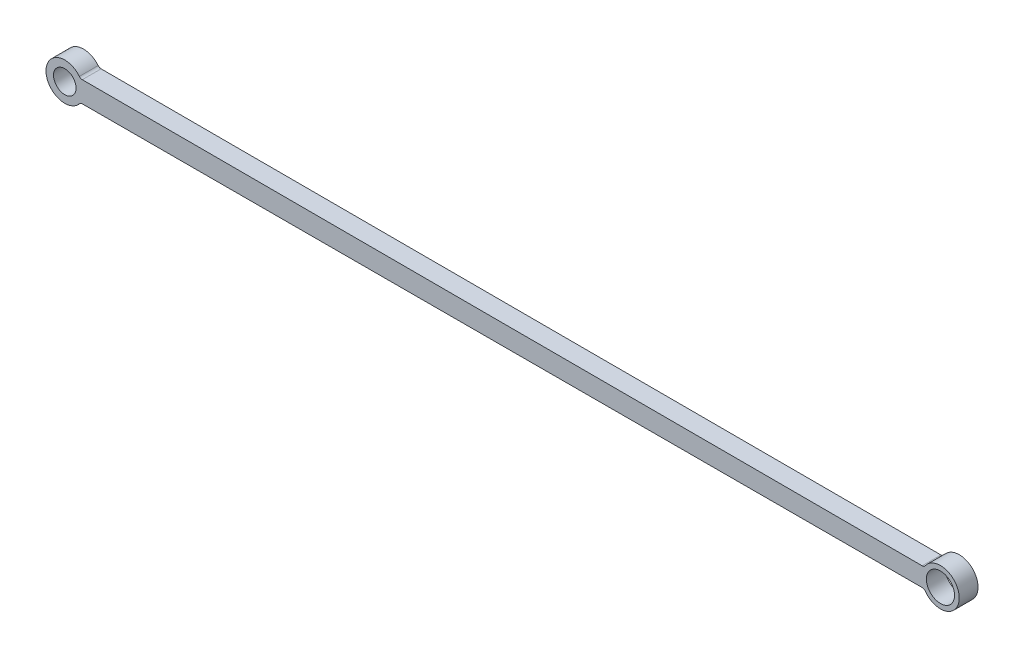
from build123d import *

# Parameters (mm, degrees)
ESBO_O1_R                = 3
ESBO_O1_R_2              = 3.75
RESSALTO_EXTRUS_O1_DEPTH = 5


with BuildPart() as part:
    # Esboço1 → Ressalto-extrusão1 (new body)
    with BuildSketch(Plane.XY):
        with BuildLine():
            Line((4.654791828, -2.784343758), (228.128552646, -2.504455311))
            ThreePointArc((228.128552646, -2.504455311), (228.585276327, -2.614204027), (228.941504241, -2.920378772))
            ThreePointArc((228.941504241, -2.920378772), (238, 0), (228.941504241, 2.920378772))
            ThreePointArc((228.941504241, 2.920378772), (228.585276327, 2.614204027), (228.128552646, 2.504455311))
            Line((228.128552646, 2.504455311), (4.654791828, 2.784343758))
            ThreePointArc((4.654791828, 2.784343758), (4.225783553, 2.881638307), (3.880036893, 3.153619145))
            ThreePointArc((3.880036893, 3.153619145), (-5, 0), (3.880036893, -3.153619145))
            ThreePointArc((3.880036893, -3.153619145), (4.225783553, -2.881638307), (4.654791828, -2.784343758))
        make_face()
        Circle(ESBO_O1_R, mode=Mode.SUBTRACT)
        with Locations((233, 0)):
            Circle(ESBO_O1_R_2, mode=Mode.SUBTRACT)
    extrude(amount=RESSALTO_EXTRUS_O1_DEPTH)


solid = part.part
